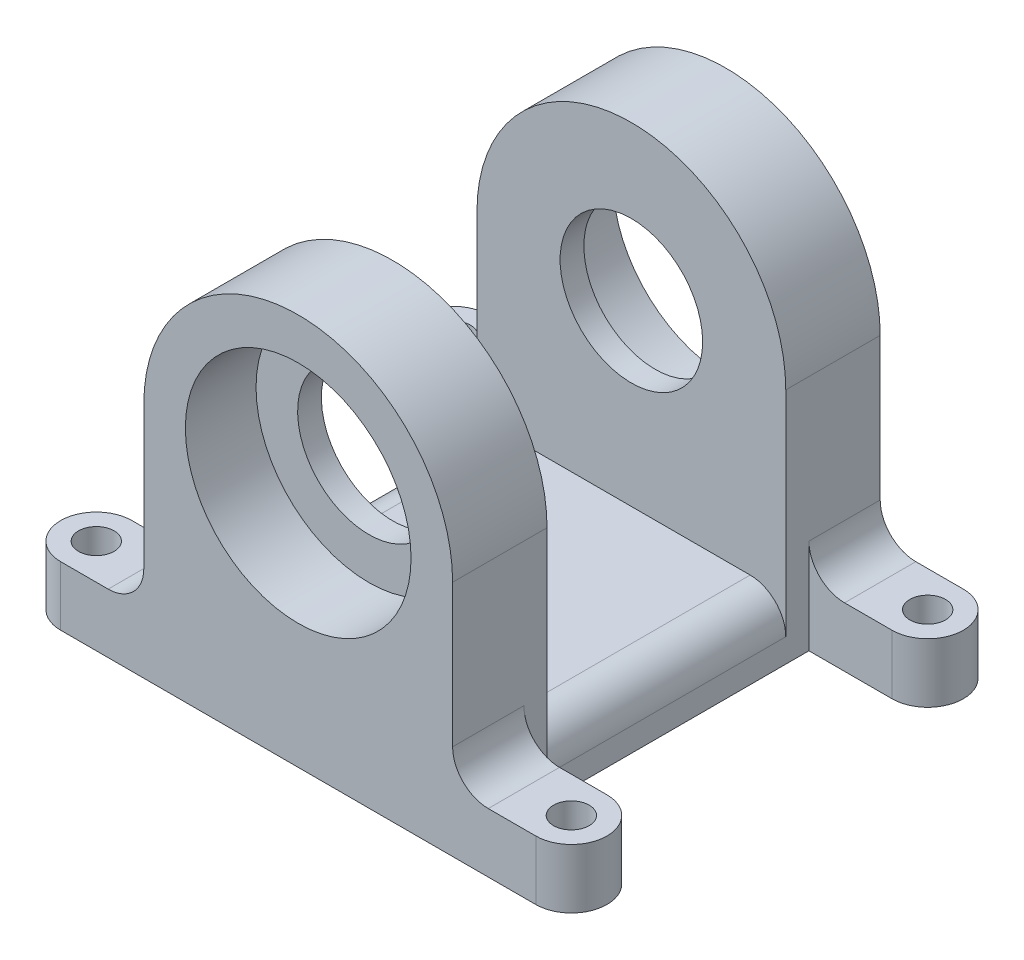
from build123d import *

# Parameters (mm, degrees)
CROQUIS1_R              = 9.5
SALIENTE_EXTRUIR1_DEPTH = 36
CROQUIS2_W              = 20.1
CROQUIS2_H              = 28
CORTAR_EXTRUIR2_DEPTH   = 49.703182648
CROQUIS3_R              = 9.5
CROQUIS3_R_2            = 6
SALIENTE_EXTRUIR2_DEPTH = 2
SALIENTE_EXTRUIR3_START = -2
CROQUIS4_R              = 9.5
CROQUIS4_R_2            = 6
SALIENTE_EXTRUIR3_DEPTH = 2
SALIENTE_EXTRUIR4_DEPTH = 5
CROQUIS6_R              = 1.5
CORTAR_EXTRUIR3_DEPTH   = 54.981478305
REDONDEO1_R             = 3
REDONDEO2_R             = 3


with BuildPart() as part:
    # Croquis1 → Saliente-Extruir1 (new body)
    with BuildSketch(Plane.XY):
        with BuildLine():
            Line((-13, 0), (-13, -20))
            Line((-13, -20), (13, -20))
            Line((13, -20), (13, 0))
            ThreePointArc((13, 0), (0, 13), (-13, 0))
        make_face()
        Circle(CROQUIS1_R, mode=Mode.SUBTRACT)
    extrude(amount=SALIENTE_EXTRUIR1_DEPTH)

    # Croquis2 → Cortar-Extruir2 (cut, through all)
    with BuildSketch(Plane(origin=(13, 0, 0), x_dir=(0, 0, -1), z_dir=(1, 0, 0))):
        with Locations((-18, -1)):
            Rectangle(CROQUIS2_W, CROQUIS2_H)
    extrude(amount=-CORTAR_EXTRUIR2_DEPTH, mode=Mode.SUBTRACT)

    # Croquis3 → Saliente-Extruir2 (add)
    with BuildSketch(Plane(origin=(0, 0, 28.05), x_dir=(-1, 0, 0), z_dir=(0, 0, -1))):
        with Locations(Location((0, 0, 0), (0, 0, 90))):
            Circle(CROQUIS3_R)
        with Locations(Location((0, 0, 0), (0, 0, 90))):
            Circle(CROQUIS3_R_2, mode=Mode.SUBTRACT)
    extrude(amount=-SALIENTE_EXTRUIR2_DEPTH)

    # Croquis4 → Saliente-Extruir3 (add)
    with BuildSketch(Plane.XY.offset(7.95).offset(SALIENTE_EXTRUIR3_START)):
        Circle(CROQUIS4_R)
        with Locations(Location((0, 0, 0), (0, 0, 90))):
            Circle(CROQUIS4_R_2, mode=Mode.SUBTRACT)
    extrude(amount=SALIENTE_EXTRUIR3_DEPTH)

    # Croquis5 → Saliente-Extruir4 (add)
    with BuildSketch(Plane.XZ.offset(20)):
        with BuildLine():
            Line((13, 36), (20, 36))
            ThreePointArc((20, 36), (23, 33), (20, 30))
            Line((20, 30), (13, 30))
            Line((13, 30), (13, 36))
        make_face()
        with BuildLine():
            Line((13, 0), (20, 0))
            ThreePointArc((20, 0), (23, 3), (20, 6))
            Line((20, 6), (13, 6))
            Line((13, 6), (13, 0))
        make_face()
        with BuildLine():
            Line((-13, 0), (-20, 0))
            ThreePointArc((-20, 0), (-23, 3), (-20, 6))
            Line((-20, 6), (-13, 6))
            Line((-13, 6), (-13, 0))
        make_face()
        with BuildLine():
            Line((-13, 30), (-13, 36))
            Line((-13, 36), (-20, 36))
            ThreePointArc((-20, 36), (-23, 33), (-20, 30))
            Line((-20, 30), (-13, 30))
        make_face()
    extrude(amount=-SALIENTE_EXTRUIR4_DEPTH)

    # Croquis6 → Cortar-Extruir3 (cut, through all)
    with BuildSketch(Plane.XZ.offset(20)):
        with Locations(Location((-20, 33, 0), (0, 0, 270))):
            Circle(CROQUIS6_R)
        with Locations(Location((20, 33, 0), (0, 0, 270))):
            Circle(CROQUIS6_R)
        with Locations(Location((-20, 3, 0), (0, 0, 270))):
            Circle(CROQUIS6_R)
        with Locations(Location((20, 3, 0), (0, 0, 270))):
            Circle(CROQUIS6_R)
    extrude(amount=-CORTAR_EXTRUIR3_DEPTH, mode=Mode.SUBTRACT)

    # Redondeo1
    redondeo1_edges = [part.edges().sort_by_distance(p)[0] for p in [
        (-13, -15, 33),
        (-13, -15, 3),
        (13, -15, 3),
        (13, -15, 33),
    ]]
    fillet(redondeo1_edges, radius=REDONDEO1_R)

    # Redondeo2
    redondeo2_edges = [part.edges().sort_by_distance(p)[0] for p in [
        (-13, -15, 18),
        (13, -15, 18),
    ]]
    fillet(redondeo2_edges, radius=REDONDEO2_R)


solid = part.part
